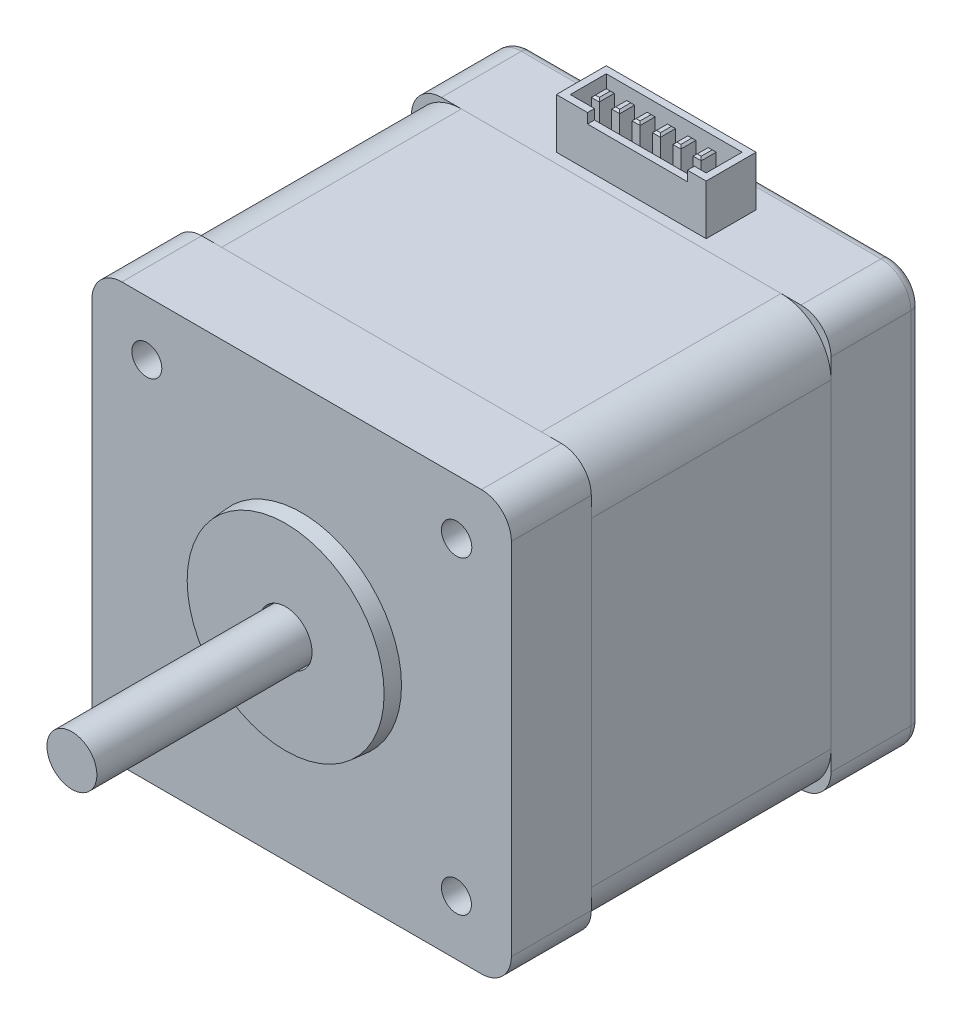
from build123d import *

# Parameters (mm, degrees)
SKETCH_1_R          = 1.5
EXTRUDE_1_DEPTH     = 8
SKETCH_4_R          = 2.5
EXTRUDE_2_DEPTH     = 23
SKETCH_9_W          = 42
SKETCH_9_H          = 42
EXTRUDE_7_DEPTH     = 24
SKETCH_10_W         = 42
SKETCH_10_H         = 42
EXTRUDE_8_DEPTH     = 9
FILLET_1_R          = 3
FILLET_2_R          = 5
SKETCH_12_R         = 1.5
SKETCH_12_R_2       = 1.518540069
CUT_EXTRUDE_1_DEPTH = 51.626080235
SKETCH_14_W         = 15
SKETCH_14_H         = 5
SKETCH_14_W_2       = 13.6
SKETCH_14_H_2       = 3.6
SKETCH_14_W_3       = 0.8
SKETCH_14_H_3       = 1.5
EXTRUDE_10_DEPTH    = 5
CHAMFER_1_SIZE      = 0.2
SKETCH_15_W         = 10
SKETCH_15_H         = 1
CUT_EXTRUDE_2_DEPTH = 0.7
FILLET_3_R          = 1
SKETCH_16_R         = 10
SKETCH_16_R_2       = 2.5
EXTRUDE_11_DEPTH    = 1.6
EXTRUDE_11_DRAFT    = 5
SKETCH_18_R         = 5
CUT_EXTRUDE_3_DEPTH = 3
EXTRUDE_START       = 2
SKETCH_19_R         = 2.5
EXTRUDE_13_DEPTH    = 2


with BuildPart() as part:
    # 草图1 → 凸台-拉伸1 (new body)
    with BuildSketch(Plane.XY):
        with BuildLine():
            Line((-18, 21), (18, 21))
            ThreePointArc((18, 21), (20.121320344, 20.121320344), (21, 18))
            Line((21, 18), (21, -18))
            ThreePointArc((21, -18), (20.121320344, -20.121320344), (18, -21))
            Line((18, -21), (-18, -21))
            ThreePointArc((-18, -21), (-20.121320344, -20.121320344), (-21, -18))
            Line((-21, -18), (-21, 18))
            ThreePointArc((-21, 18), (-20.121320344, 20.121320344), (-18, 21))
        make_face()
        with Locations((-15.5, 15.5)):
            Circle(SKETCH_1_R, mode=Mode.SUBTRACT)
        with Locations(Location((15.5, 15.5, 0), (0, 0, 180))):
            Circle(SKETCH_1_R, mode=Mode.SUBTRACT)
        with Locations((15.5, -15.5)):
            Circle(SKETCH_1_R, mode=Mode.SUBTRACT)
        with Locations(Location((-15.5, -15.5, 0), (0, 0, 180))):
            Circle(SKETCH_1_R, mode=Mode.SUBTRACT)
    extrude(amount=EXTRUDE_1_DEPTH)

    # 草图4 → 凸台-拉伸2 (add)
    with BuildSketch(Plane.XY.offset(8)):
        with Locations(Location((0, 0, 0), (0, 0, 180))):
            Circle(SKETCH_4_R)
    extrude(amount=EXTRUDE_2_DEPTH)


with BuildPart() as body_2:
    # 草图9 → 凸台-拉伸7 (new body)
    with BuildSketch(Plane(origin=(0, 0, 0), x_dir=(-1, 0, 0), z_dir=(0, 0, -1))):
        Rectangle(SKETCH_9_W, SKETCH_9_H)
    extrude(amount=EXTRUDE_7_DEPTH)

    # 圆角2
    fillet_2_edges = [body_2.edges().sort_by_distance(p)[0] for p in [
        (-21, -21, -12),
        (21, -21, -12),
        (21, 21, -12),
        (-21, 21, -12),
    ]]
    fillet(fillet_2_edges, radius=FILLET_2_R)


with BuildPart() as body_3:
    # 草图10 → 凸台-拉伸8 (new body)
    with BuildSketch(Plane(origin=(0, 0, -24), x_dir=(-1, 0, 0), z_dir=(0, 0, -1))):
        Rectangle(SKETCH_10_W, SKETCH_10_H)
    extrude(amount=EXTRUDE_8_DEPTH)

    # 圆角1
    fillet_1_edges = [body_3.edges().sort_by_distance(p)[0] for p in [
        (21, 21, -28.5),
        (-21, 21, -28.5),
        (-21, -21, -28.5),
        (21, -21, -28.5),
    ]]
    fillet(fillet_1_edges, radius=FILLET_1_R)


with BuildPart() as cut_extrude_1_tool:
    # 草图12 → 切除-拉伸1 (new, through all)
    with BuildSketch(Plane.XY.offset(8)):
        with Locations((-15.5, 15.5)):
            Circle(SKETCH_12_R)
        with Locations((15.518540069, 15.5)):
            Circle(SKETCH_12_R_2)
        with Locations((-15.5, -15.5)):
            Circle(SKETCH_12_R)
        with Locations((15.5, -15.5)):
            Circle(SKETCH_12_R)
    extrude(amount=-CUT_EXTRUDE_1_DEPTH)


with BuildPart() as part_1:
    add(part.part)

    # 切除-拉伸1: cut by cut_extrude_1_tool
    add(cut_extrude_1_tool.part, mode=Mode.SUBTRACT)


with BuildPart() as body_2_1:
    add(body_2.part)

    # 切除-拉伸1: cut by cut_extrude_1_tool
    add(cut_extrude_1_tool.part, mode=Mode.SUBTRACT)


with BuildPart() as body_3_1:
    add(body_3.part)

    # 切除-拉伸1: cut by cut_extrude_1_tool
    add(cut_extrude_1_tool.part, mode=Mode.SUBTRACT)

    # 草图14 → 凸台-拉伸10 (add)
    # profile 1 of 7: a face of its own
    with BuildSketch(Plane(origin=(0, 21, 0), x_dir=(1, 0, 0), z_dir=(0, 1, 0))):
        with Locations((0, 27.5)):
            Rectangle(SKETCH_14_W, SKETCH_14_H)
        with Locations((0, 27.5)):
            Rectangle(SKETCH_14_W_2, SKETCH_14_H_2, mode=Mode.SUBTRACT)
    # profile 2 of 7: a face of its own
    with BuildSketch(Plane(origin=(0, 21, 0), x_dir=(1, 0, 0), z_dir=(0, 1, 0))):
        with Locations((-5.3, 27.457329348)):
            Rectangle(SKETCH_14_W_3, SKETCH_14_H_3)
    # profile 3 of 7: a face of its own
    with BuildSketch(Plane(origin=(0, 21, 0), x_dir=(1, 0, 0), z_dir=(0, 1, 0))):
        with Locations((-1.22, 27.457329348)):
            Rectangle(SKETCH_14_W_3, SKETCH_14_H_3)
    # profile 4 of 7: a face of its own
    with BuildSketch(Plane(origin=(0, 21, 0), x_dir=(1, 0, 0), z_dir=(0, 1, 0))):
        with Locations((4.9, 27.457329348)):
            Rectangle(SKETCH_14_W_3, SKETCH_14_H_3)
    # profile 5 of 7: a face of its own
    with BuildSketch(Plane(origin=(0, 21, 0), x_dir=(1, 0, 0), z_dir=(0, 1, 0))):
        with Locations((2.86, 27.457329348)):
            Rectangle(SKETCH_14_W_3, SKETCH_14_H_3)
    # profile 6 of 7: a face of its own
    with BuildSketch(Plane(origin=(0, 21, 0), x_dir=(1, 0, 0), z_dir=(0, 1, 0))):
        with Locations((-3.26, 27.457329348)):
            Rectangle(SKETCH_14_W_3, SKETCH_14_H_3)
    # profile 7 of 7: a face of its own
    with BuildSketch(Plane(origin=(0, 21, 0), x_dir=(1, 0, 0), z_dir=(0, 1, 0))):
        with Locations((0.82, 27.457329348)):
            Rectangle(SKETCH_14_W_3, SKETCH_14_H_3)
    extrude(amount=EXTRUDE_10_DEPTH)

    # 倒角1
    chamfer_1_edges = [body_3_1.edges().sort_by_distance(p)[0] for p in [
        (5.3, 26, -27.457329348),
        (4.9, 26, -28.207329348),
        (4.5, 26, -27.457329348),
        (4.9, 26, -26.707329348),
        (3.26, 26, -27.457329348),
        (2.86, 26, -28.207329348),
        (2.46, 26, -27.457329348),
        (2.86, 26, -26.707329348),
        (-2.86, 26, -27.457329348),
        (-3.26, 26, -28.207329348),
        (-3.66, 26, -27.457329348),
        (-3.26, 26, -26.707329348),
        (1.22, 26, -27.457329348),
        (0.82, 26, -28.207329348),
        (0.42, 26, -27.457329348),
        (0.82, 26, -26.707329348),
        (-4.9, 26, -27.457329348),
        (-5.3, 26, -28.207329348),
        (-5.7, 26, -27.457329348),
        (-5.3, 26, -26.707329348),
        (-0.82, 26, -27.457329348),
        (-1.22, 26, -28.207329348),
        (-1.62, 26, -27.457329348),
        (-1.22, 26, -26.707329348),
    ]]
    chamfer(chamfer_1_edges, length=CHAMFER_1_SIZE)

    # 草图15 → 切除-拉伸2 (cut)
    with BuildSketch(Plane.XY.offset(-25)):
        with Locations((0.62, 25.5)):
            Rectangle(SKETCH_15_W, SKETCH_15_H)
    extrude(amount=-CUT_EXTRUDE_2_DEPTH, mode=Mode.SUBTRACT)

    # 圆角3
    fillet_3_edges = [body_3_1.edges().sort_by_distance(p)[0] for p in [
        (0, -21, -33),
        (21, 0, -33),
        (-21, 0, -33),
        (0, 21, -33),
        (20.121320344, 20.121320344, -33),
        (-20.121320344, 20.121320344, -33),
        (-20.121320344, -20.121320344, -33),
        (20.121320344, -20.121320344, -33),
    ]]
    fillet(fillet_3_edges, radius=FILLET_3_R)

    # 草图18 → 切除-拉伸3 (cut)
    with BuildSketch(Plane(origin=(0, 0, -33), x_dir=(-1, 0, 0), z_dir=(0, 0, -1))):
        Circle(SKETCH_18_R)
    extrude(amount=-CUT_EXTRUDE_3_DEPTH, mode=Mode.SUBTRACT)

    # 草图19 → 凸台-拉伸13 (add)
    with BuildSketch(Plane(origin=(0, 0, -30), x_dir=(-1, 0, 0), z_dir=(0, 0, -1)).offset(EXTRUDE_START)):
        Circle(SKETCH_19_R)
    extrude(amount=-EXTRUDE_13_DEPTH)


with BuildPart() as extrude_11_tool:
    # 草图16 → 凸台-拉伸11 (with draft: the straight prism first)
    with BuildSketch(Plane.XY.offset(8)):
        Circle(SKETCH_16_R)
        Circle(SKETCH_16_R_2, mode=Mode.SUBTRACT)
    extrude(amount=EXTRUDE_11_DEPTH)
    # 凸台-拉伸11: the draft: its side faces are tilted about the plane it starts from
    extrude_11_sides = [extrude_11_tool.faces().sort_by_distance(p)[0] for p in [
        (-10, 0, 8.8),
        (-2.5, 0, 8.8),
    ]]
    draft(extrude_11_sides, Plane.XY.offset(8), EXTRUDE_11_DRAFT)


with BuildPart() as part_2:
    add(part_1.part)

    # 凸台-拉伸11: add extrude_11_tool
    add(extrude_11_tool.part)


solid = Compound([body_2_1.part, body_3_1.part, part_2.part])
